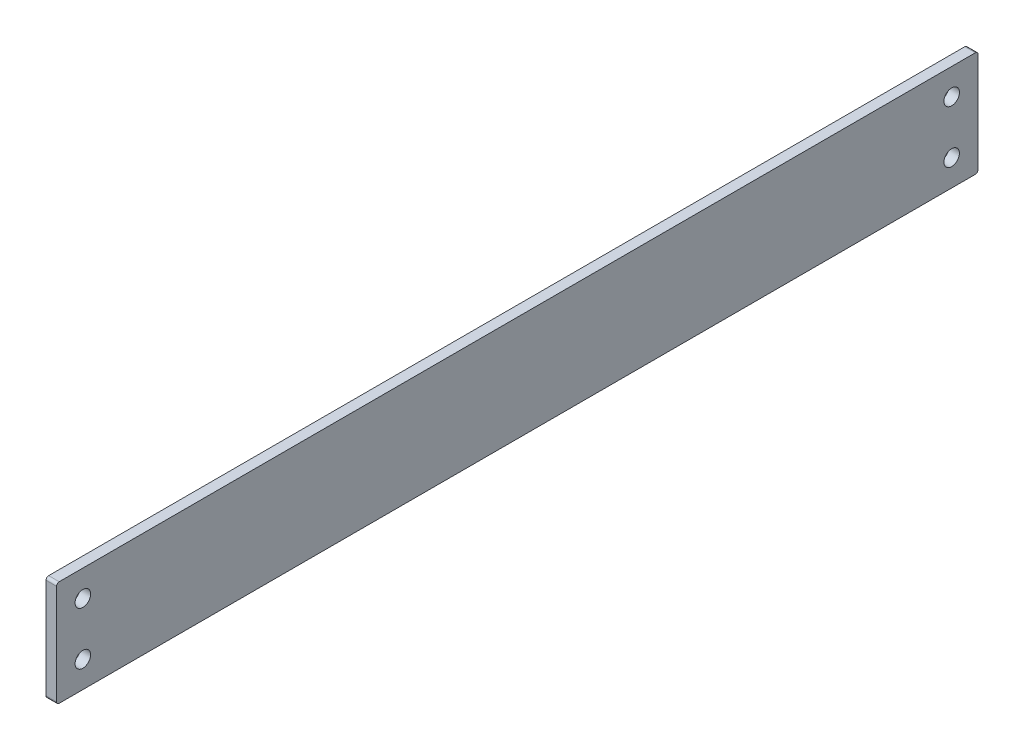
from build123d import *

# Parameters (mm, degrees)
SKETCH_1_W      = 350
SKETCH_1_H      = 40
SKETCH_1_R      = 2.95
EXTRUDE_1_DEPTH = 4
FILLET_1_R      = 1


with BuildPart() as part:
    # 草图1 → 凸台-拉伸1 (new body)
    with BuildSketch(Plane(origin=(0, 0, 0), x_dir=(0, 0, -1), z_dir=(1, 0, 0))):
        with Locations((175, 20)):
            Rectangle(SKETCH_1_W, SKETCH_1_H)
        with Locations((10, 30)):
            Circle(SKETCH_1_R, mode=Mode.SUBTRACT)
        with Locations((10, 10)):
            Circle(SKETCH_1_R, mode=Mode.SUBTRACT)
        with Locations(Location((340, 10, 0), (0, 0, 180))):
            Circle(SKETCH_1_R, mode=Mode.SUBTRACT)
        with Locations(Location((340, 30, 0), (0, 0, 180))):
            Circle(SKETCH_1_R, mode=Mode.SUBTRACT)
    extrude(amount=EXTRUDE_1_DEPTH)

    # 圆角1
    fillet_1_edges = [part.edges().sort_by_distance(p)[0] for p in [
        (2, 40, 0),
        (2, 40, -350),
        (2, 0, -350),
        (2, 0, 0),
    ]]
    fillet(fillet_1_edges, radius=FILLET_1_R)


solid = part.part
